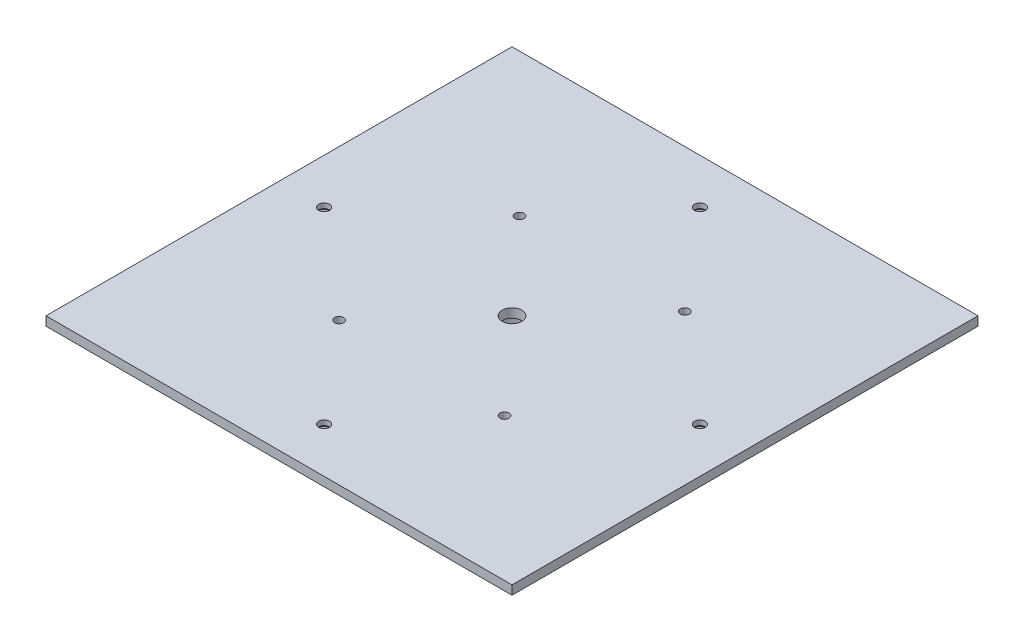
from build123d import *

# Parameters (mm, degrees)
SKETCH10_W                                     = 155
SKETCH10_H                                     = 155
BOSS_EXTRUDE3_DEPTH                            = 3
SKETCH11_R                                     = 17.5
SKETCH11_R_2                                   = 12.59
BOSS_EXTRUDE4_DEPTH                            = 8.4
SKETCH11_4_R                                   = 2.3
BOSS_EXTRUDE6_DEPTH                            = 4
SKETCH12_R                                     = 2.55
CUT_EXTRUDE1_DEPTH                             = 37
SKETCH14_R                                     = 2.55
CUT_EXTRUDE2_DEPTH                             = 75
SKETCH15_R                                     = 1.5
SKETCH15_R_2                                   = 3.25
CUT_EXTRUDE3_DEPTH                             = 95
CSK_FOR_M3_FLAT_HEAD_MACHINE_SCREW1_AT_2_COUNT = 2
CSK_FOR_M3_FLAT_HEAD_MACHINE_SCREW1_AT_2_PITCH = 88.388347648
CSK_FOR_M3_FLAT_HEAD_MACHINE_SCREW1_AT_3_COUNT = 2
CSK_FOR_M3_FLAT_HEAD_MACHINE_SCREW1_AT_3_PITCH = 125
CSK_FOR_M3_FLAT_HEAD_MACHINE_SCREW1_AT_4_COUNT = 2
CSK_FOR_M3_FLAT_HEAD_MACHINE_SCREW1_AT_4_PITCH = 88.388347648


with BuildPart() as part:
    # Sketch10 → Boss-Extrude3 (new body)
    with BuildSketch(Plane.XZ):
        with Locations((-75.370825338, 0)):
            Rectangle(SKETCH10_W, SKETCH10_H)
    extrude(amount=BOSS_EXTRUDE3_DEPTH)

    # Sketch11 → Boss-Extrude4 (add)
    with BuildSketch(Plane.XZ.offset(3)):
        with Locations((-75.370825338, 0)):
            Circle(SKETCH11_R)
        with Locations((-75.370825338, 0)):
            Circle(SKETCH11_R_2, mode=Mode.SUBTRACT)
    extrude(amount=BOSS_EXTRUDE4_DEPTH)

    # Sketch11<4> → Boss-Extrude6 (add)
    with BuildSketch(Plane.XZ.offset(3)):
        with Locations((-135.260825338, 59.89)):
            Circle(SKETCH11_4_R)
        with Locations((-15.480825338, 59.89)):
            Circle(SKETCH11_4_R)
        with Locations((-15.480825338, -59.89)):
            Circle(SKETCH11_4_R)
        with Locations((-135.260825338, -59.89)):
            Circle(SKETCH11_4_R)
    extrude(amount=BOSS_EXTRUDE6_DEPTH)

    # Sketch12 → Cut-Extrude1 (cut)
    with BuildSketch(Plane.XY):
        with Locations((-75.370825338, -6.9)):
            Circle(SKETCH12_R)
    extrude(amount=-CUT_EXTRUDE1_DEPTH, mode=Mode.SUBTRACT)

    # Sketch14 → Cut-Extrude2 (cut)
    with BuildSketch(Plane(origin=(0, 0, 0), x_dir=(0, 0, -1), z_dir=(1, 0, 0))):
        with Locations((0, -6.9)):
            Circle(SKETCH14_R)
    extrude(amount=-CUT_EXTRUDE2_DEPTH, mode=Mode.SUBTRACT)

    # Sketch15 → Cut-Extrude3 (cut)
    with BuildSketch(Plane(origin=(0, 0, 0), x_dir=(1, 0, 0), z_dir=(0, 1, 0))):
        with Locations((-102.870825338, 30)):
            Circle(SKETCH15_R)
        with Locations((-47.870825338, 30)):
            Circle(SKETCH15_R)
        with Locations((-47.870825338, -30)):
            Circle(SKETCH15_R)
        with Locations((-102.870825338, -30)):
            Circle(SKETCH15_R)
        with Locations((-75.370825338, 0)):
            Circle(SKETCH15_R_2)
    extrude(amount=-CUT_EXTRUDE3_DEPTH, mode=Mode.SUBTRACT)

    # Sketch18 → CSK for M3 Flat Head Machine Screw1 (revolve, cut)
    with BuildSketch(Plane(origin=(-75.370825338, -3, -62.5), x_dir=(0, 0, -1), z_dir=(1, 0, 0))):
        Polygon((0, 0), (0, 3), (1.8, 3), (1.8, 1.35), (3.15, 0), align=None)
    csk_for_m3_flat_head_machine_screw1 = revolve(axis=Axis((-75.370825338, -9.35, -62.5), (0, 1, 0)), mode=Mode.SUBTRACT)

    # CSK for M3 Flat Head Machine Screw1 at 2: CSK for M3 Flat Head Machine Screw1 ×2
    with Locations(*[Vector(0.7071067811865477, 0, 0.7071067811865474) * (i * CSK_FOR_M3_FLAT_HEAD_MACHINE_SCREW1_AT_2_PITCH) for i in range(1, CSK_FOR_M3_FLAT_HEAD_MACHINE_SCREW1_AT_2_COUNT)]):
        add(csk_for_m3_flat_head_machine_screw1, mode=Mode.SUBTRACT)

    # CSK for M3 Flat Head Machine Screw1 at 3: CSK for M3 Flat Head Machine Screw1 ×2
    with Locations(*[(0, 0, i * CSK_FOR_M3_FLAT_HEAD_MACHINE_SCREW1_AT_3_PITCH) for i in range(1, CSK_FOR_M3_FLAT_HEAD_MACHINE_SCREW1_AT_3_COUNT)]):
        add(csk_for_m3_flat_head_machine_screw1, mode=Mode.SUBTRACT)

    # CSK for M3 Flat Head Machine Screw1 at 4: CSK for M3 Flat Head Machine Screw1 ×2
    with Locations(*[Vector(-0.7071067811865479, 0, 0.7071067811865472) * (i * CSK_FOR_M3_FLAT_HEAD_MACHINE_SCREW1_AT_4_PITCH) for i in range(1, CSK_FOR_M3_FLAT_HEAD_MACHINE_SCREW1_AT_4_COUNT)]):
        add(csk_for_m3_flat_head_machine_screw1, mode=Mode.SUBTRACT)


solid = part.part
